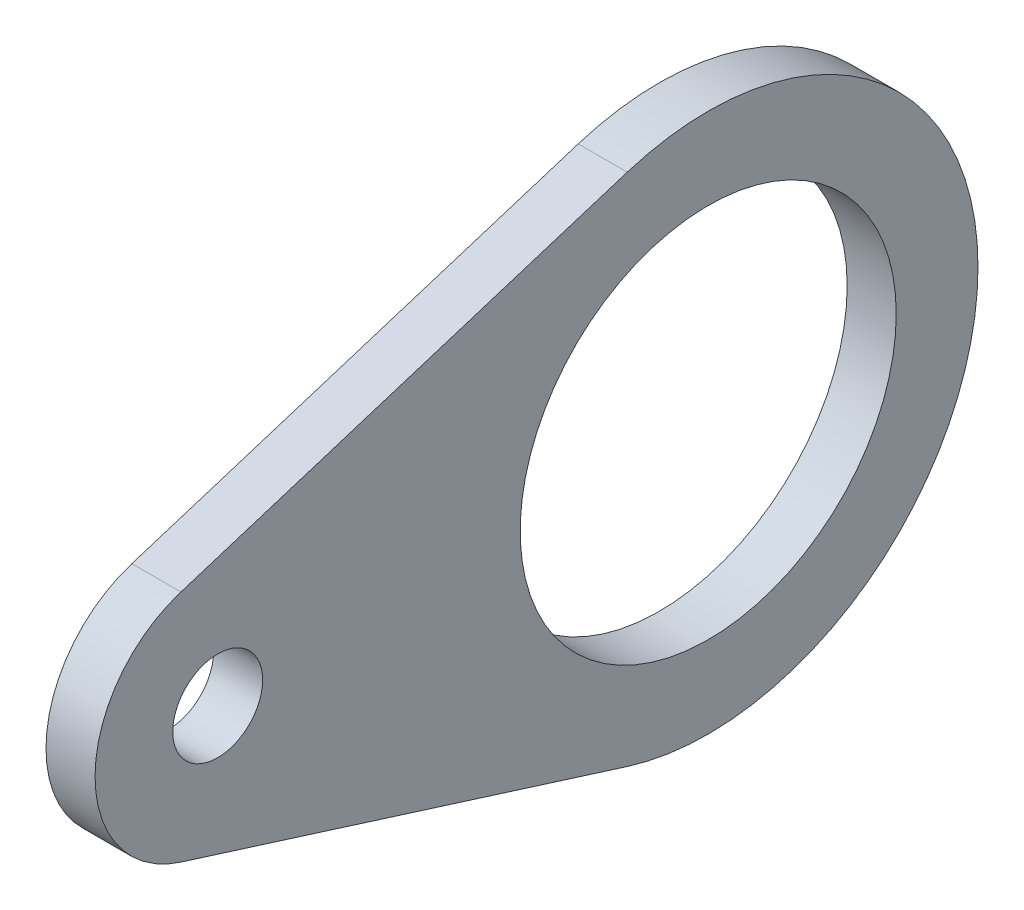
from build123d import *

# Parameters (mm, degrees)
SKETCH_1_R      = 23
SKETCH_1_R_2    = 5.5
EXTRUDE_1_DEPTH = 6


with BuildPart() as part:
    # 草图1 → 凸台-拉伸1 (new body)
    with BuildSketch(Plane(origin=(0, 0, 0), x_dir=(0, 0, -1), z_dir=(1, 0, 0))):
        with BuildLine():
            Line((-64.5, 14.309088021), (-9.9, 31.479993647))
            ThreePointArc((-9.9, 31.479993647), (33, 0), (-9.9, -31.479993647))
            Line((-9.9, -31.479993647), (-64.5, -14.309088021))
            ThreePointArc((-64.5, -14.309088021), (-75, 0), (-64.5, 14.309088021))
        make_face()
        Circle(SKETCH_1_R, mode=Mode.SUBTRACT)
        with Locations((-60, 0)):
            Circle(SKETCH_1_R_2, mode=Mode.SUBTRACT)
    extrude(amount=EXTRUDE_1_DEPTH)


solid = part.part
